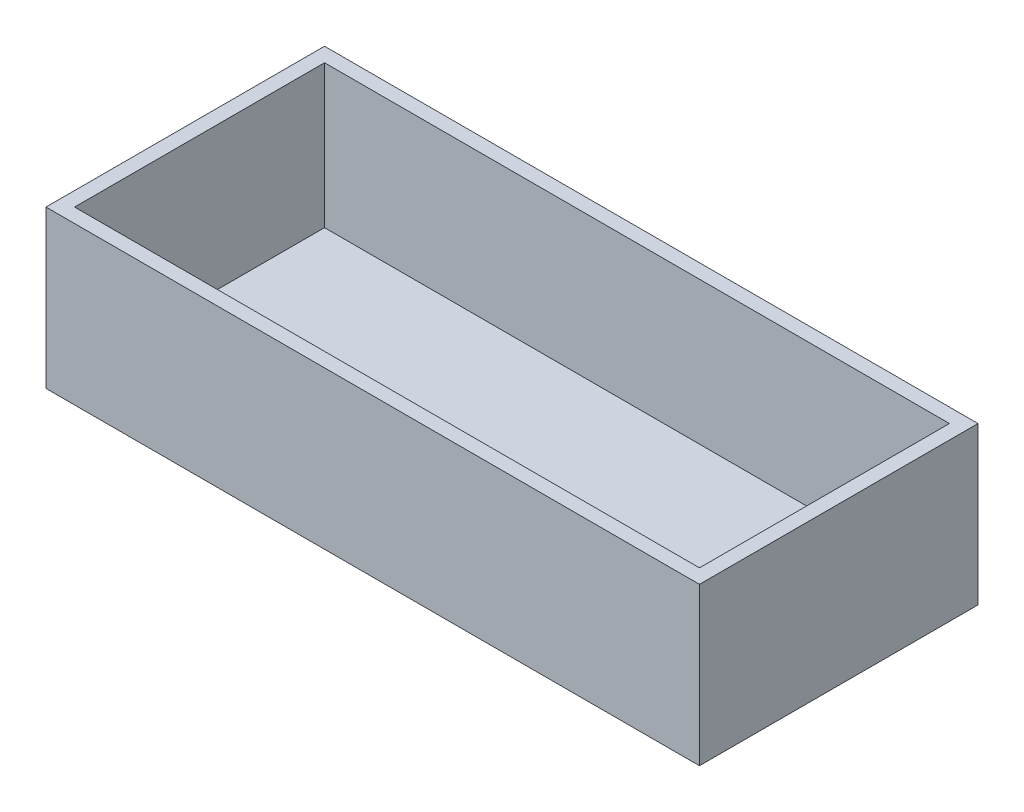
from build123d import *

# Parameters (mm, degrees)
SKETCH1_W           = 91.5
SKETCH1_H           = 39
SKETCH1_W_2         = 87.5
SKETCH1_H_2         = 35
BOSS_EXTRUDE1_DEPTH = 20
SKETCH2_W           = 91.5
SKETCH2_H           = 39
BOSS_EXTRUDE2_DEPTH = 2


with BuildPart() as part:
    # Sketch1 → Boss-Extrude1 (new body)
    with BuildSketch(Plane(origin=(0, 0, 0), x_dir=(1, 0, 0), z_dir=(0, 1, 0))):
        with Locations((13.861386139, -4.865924092)):
            Rectangle(SKETCH1_W, SKETCH1_H)
        with Locations((13.861386139, -4.865924092)):
            Rectangle(SKETCH1_W_2, SKETCH1_H_2, mode=Mode.SUBTRACT)
    extrude(amount=BOSS_EXTRUDE1_DEPTH)

    # Sketch2 → Boss-Extrude2 (add)
    with BuildSketch(Plane.XZ):
        with Locations((13.861386139, 4.865924092)):
            Rectangle(SKETCH2_W, SKETCH2_H)
    extrude(amount=BOSS_EXTRUDE2_DEPTH)


solid = part.part
